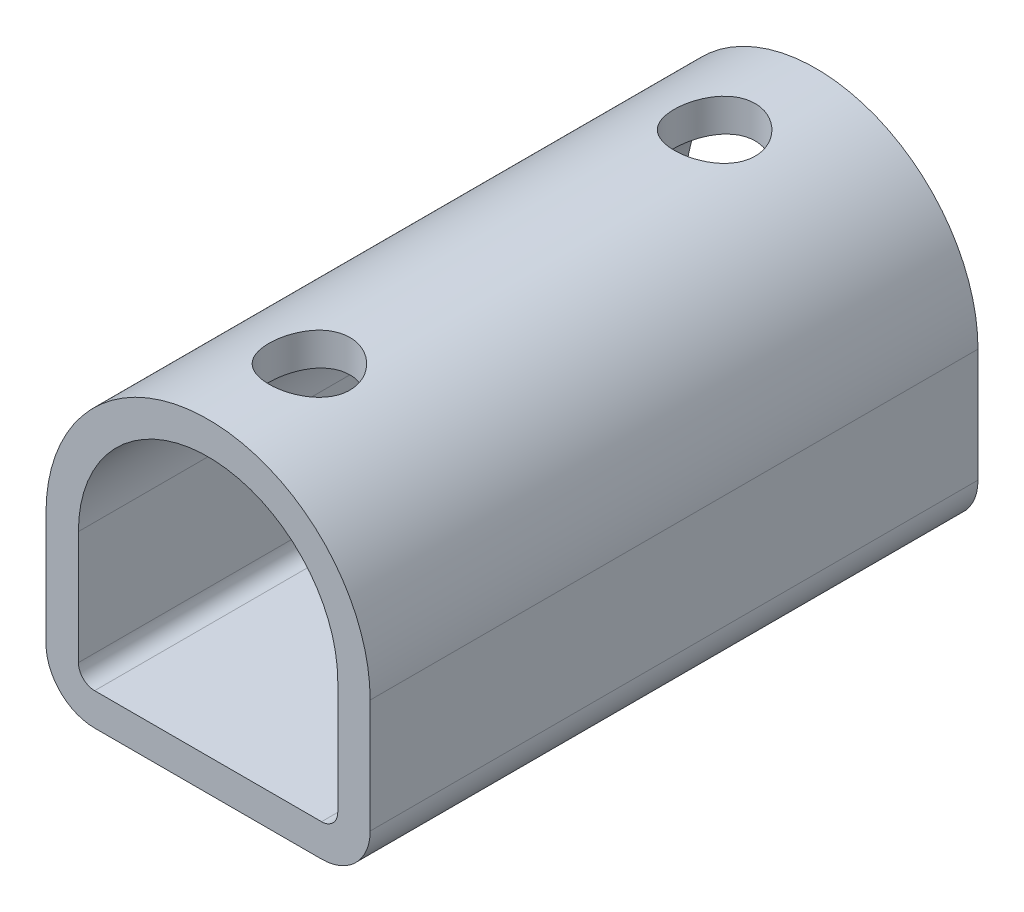
from build123d import *

# Parameters (mm, degrees)
BOSS_EXTRU_1_DEPTH      = 75
ESQUISSE2_R             = 5
ENL_V_MAT_EXTRU_1_DEPTH = 75


with BuildPart() as part:
    # Esquisse1 → Boss.-Extru.1 (new body)
    with BuildSketch(Plane.XY):
        with BuildLine():
            Line((-20.64171123, -0.577540107), (-20.64171123, 13.422459893))
            ThreePointArc((-20.64171123, 13.422459893), (-0.64171123, 33.422459893), (19.35828877, 13.422459893))
            Line((19.35828877, 13.422459893), (19.35828877, -0.577540107))
            ThreePointArc((19.35828877, -0.577540107), (17.600929457, -4.820180794), (13.35828877, -6.577540107))
            Line((13.35828877, -6.577540107), (-14.64171123, -6.577540107))
            ThreePointArc((-14.64171123, -6.577540107), (-18.884351917, -4.820180794), (-20.64171123, -0.577540107))
        make_face()
        with BuildLine():
            Line((13.35828877, -2.577540107), (-14.64171123, -2.577540107))
            ThreePointArc((-14.64171123, -2.577540107), (-16.055924792, -1.991753669), (-16.64171123, -0.577540107))
            Line((-16.64171123, -0.577540107), (-16.64171123, 13.422459893))
            ThreePointArc((-16.64171123, 13.422459893), (-0.64171123, 29.422459893), (15.35828877, 13.422459893))
            Line((15.35828877, 13.422459893), (15.35828877, -0.577540107))
            ThreePointArc((15.35828877, -0.577540107), (14.772502332, -1.991753669), (13.35828877, -2.577540107))
        make_face(mode=Mode.SUBTRACT)
    extrude(amount=BOSS_EXTRU_1_DEPTH)

    # Esquisse2 → Enlèv. mat.-Extru.1 (cut)
    with BuildSketch(Plane(origin=(0, 0, 0), x_dir=(1, 0, 0), z_dir=(0, 1, 0))):
        with Locations(Location((-0.64171123, -12.5, 0), (0, 0, 90))):
            Circle(ESQUISSE2_R)
        with Locations(Location((-0.64171123, -62.5, 0), (0, 0, 90))):
            Circle(ESQUISSE2_R)
    extrude(amount=ENL_V_MAT_EXTRU_1_DEPTH, mode=Mode.SUBTRACT)


solid = part.part
